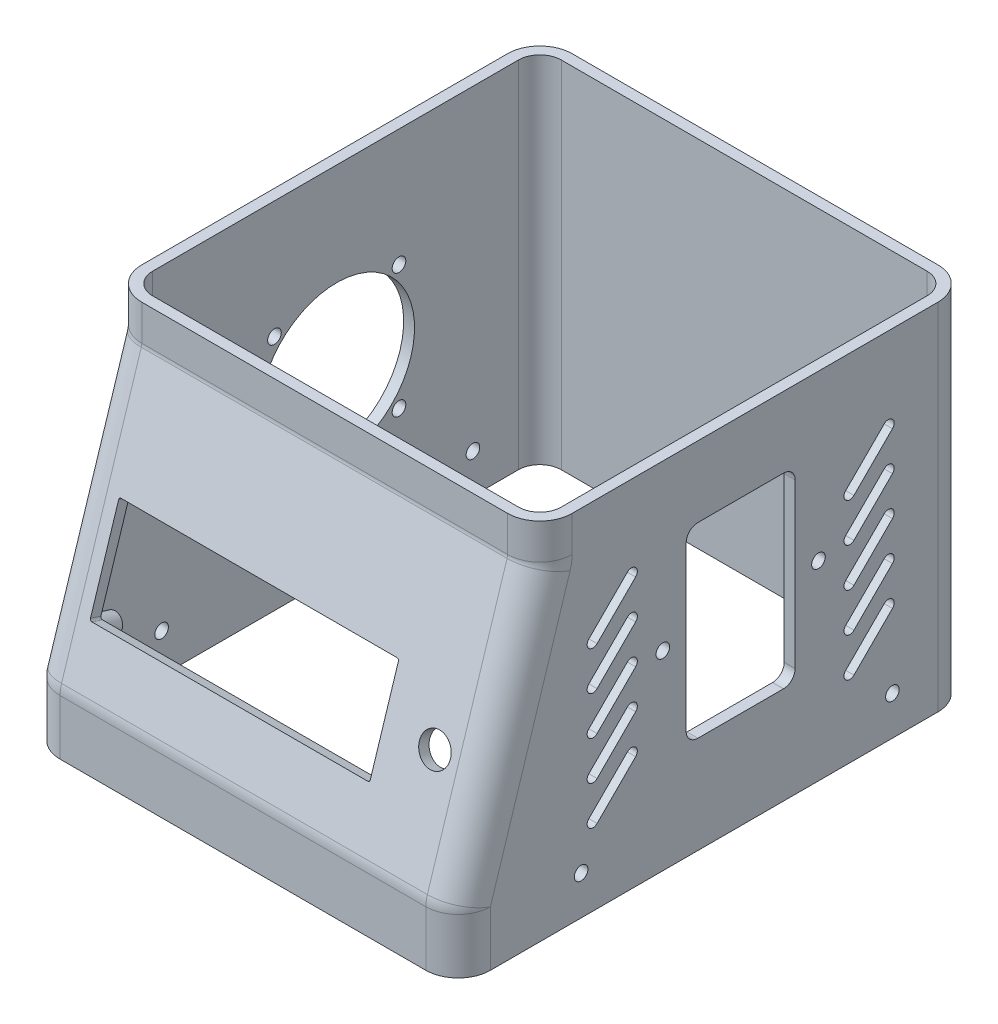
from build123d import *

# Parameters (mm, degrees)
BOSS_EXTRUDE3_DEPTH = 52.5
FILLET3_R           = 5.5
SHELL1_T            = 2.8
CUT_EXTRUDE1_REACH  = 171.85
SKETCH7_R           = 2.5
SKETCH7_R_2         = 1.25
BOSS_EXTRUDE4_DEPTH = 5.7
CUT_EXTRUDE2_REACH  = 173.509
SKETCH8_R           = 4
SKETCH11_R          = 1.75
CUT_EXTRUDE3_DEPTH  = 193.715437887
SKETCH12_R          = 1.75
SKETCH12_W          = 28
SKETCH12_H          = 48
CUT_EXTRUDE4_DEPTH  = 2.8
SKETCH17_R          = 2.5
SKETCH17_R_2        = 1.25
BOSS_EXTRUDE7_DEPTH = 8.4
FILLET4_R           = 3
SKETCH18_R          = 20
SKETCH18_R_2        = 1.75
CUT_EXTRUDE6_DEPTH  = 2.8
CUT_EXTRUDE7_DEPTH  = 2.8


with BuildPart() as part:
    # Sketch4 → Boss-Extrude3 (new, symmetric)
    with BuildSketch(Plane(origin=(0, 0, 0), x_dir=(0, 0, -1), z_dir=(1, 0, 0))):
        Polygon((0, 0), (0, 15), (21, 81.2), (21, 91.2), (126, 91.2), (126, 0), align=None)
    extrude(amount=BOSS_EXTRUDE3_DEPTH, both=True)

    # Fillet3
    fillet3_edges = [part.edges().sort_by_distance(p)[0] for p in [
        (0, 15, 0),
        (0, 81.2, -21),
        (52.5, 86.2, -21),
        (52.5, 48.1, -10.5),
        (52.5, 7.5, 0),
        (-52.5, 7.5, 0),
        (-52.5, 48.1, -10.5),
        (-52.5, 86.2, -21),
        (52.5, 45.6, -126),
        (-52.5, 45.6, -126),
    ]]
    fillet(fillet3_edges, radius=FILLET3_R)

    # Shell1
    shell1_openings = [part.faces().sort_by_distance(p)[0] for p in [
        (0, 0, -63),
        (0, 91.2, -73.5),
    ]]
    offset(amount=SHELL1_T, openings=shell1_openings, kind=Kind.INTERSECTION)

    # Sketch6 → Cut-Extrude1 (cut, up to next)
    with BuildSketch(Plane(origin=(0, 1.371427861, 4.323263065), x_dir=(-1, 0, 0), z_dir=(0, -0.30237150004743096, -0.953190157292377)), mode=Mode.PRIVATE) as cut_extrude1_sk1:
        with BuildLine():
            Line((-27.45, 54.049302099), (43.45, 54.049302099))
            ThreePointArc((43.45, 54.049302099), (43.803553391, 53.902855489), (43.95, 53.549302099))
            Line((43.95, 53.549302099), (43.95, 29.649302099))
            ThreePointArc((43.95, 29.649302099), (43.803553391, 29.295748708), (43.45, 29.149302099))
            Line((43.45, 29.149302099), (-27.45, 29.149302099))
            ThreePointArc((-27.45, 29.149302099), (-27.803553391, 29.295748708), (-27.95, 29.649302099))
            Line((-27.95, 29.649302099), (-27.95, 53.549302099))
            ThreePointArc((-27.95, 53.549302099), (-27.803553391, 53.902855489), (-27.45, 54.049302099))
        make_face()
    cut_extrude1_tool1 = extrude(cut_extrude1_sk1.sketch, amount=-CUT_EXTRUDE1_REACH, mode=Mode.PRIVATE) & part.part
    add(cut_extrude1_tool1.solids().sort_by_distance((-8, 41.023473, -8.25518))[0], mode=Mode.SUBTRACT)

    # Sketch7 → Boss-Extrude4 (add)
    # profile 1 of 4: a face of its own
    with BuildSketch(Plane(origin=(0, 1.371427861, 4.323263065), x_dir=(-1, 0, 0), z_dir=(0, -0.30237150004743096, -0.953190157292377))):
        with Locations(Location((-29.5, 57.599302099, 0), (0, 0, 90))):
            Circle(SKETCH7_R)
        with Locations(Location((-29.5, 57.599302099, 0), (0, 0, 90))):
            Circle(SKETCH7_R_2, mode=Mode.SUBTRACT)
    # profile 2 of 4: a face of its own
    with BuildSketch(Plane(origin=(0, 1.371427861, 4.323263065), x_dir=(-1, 0, 0), z_dir=(0, -0.30237150004743096, -0.953190157292377))):
        with Locations(Location((45.5, 57.599302099, 0), (0, 0, 306.869897646))):
            Circle(SKETCH7_R)
        with Locations(Location((45.5, 57.599302099, 0), (0, 0, 90))):
            Circle(SKETCH7_R_2, mode=Mode.SUBTRACT)
    # profile 3 of 4: a face of its own
    with BuildSketch(Plane(origin=(0, 1.371427861, 4.323263065), x_dir=(-1, 0, 0), z_dir=(0, -0.30237150004743096, -0.953190157292377))):
        with Locations(Location((45.5, 26.599302099, 0), (0, 0, 306.869897646))):
            Circle(SKETCH7_R)
        with Locations(Location((45.5, 26.599302099, 0), (0, 0, 90))):
            Circle(SKETCH7_R_2, mode=Mode.SUBTRACT)
    # profile 4 of 4: a face of its own
    with BuildSketch(Plane(origin=(0, 1.371427861, 4.323263065), x_dir=(-1, 0, 0), z_dir=(0, -0.30237150004743096, -0.953190157292377))):
        with Locations(Location((-29.5, 26.599302099, 0), (0, 0, 90))):
            Circle(SKETCH7_R)
        with Locations(Location((-29.5, 26.599302099, 0), (0, 0, 90))):
            Circle(SKETCH7_R_2, mode=Mode.SUBTRACT)
    extrude(amount=BOSS_EXTRUDE4_DEPTH)

    # Sketch8 → Cut-Extrude2 (cut, up to next)
    with BuildSketch(Plane(origin=(0, 2.218068061, 6.992195506), x_dir=(1, 0, 0), z_dir=(0, 0.30237150004743096, 0.953190157292377)), mode=Mode.PRIVATE) as cut_extrude2_sk1:
        with Locations(Location((40.95, 41.599302099, 0), (0, 0, 270))):
            Circle(SKETCH8_R)
    cut_extrude2_tool1 = extrude(cut_extrude2_sk1.sketch, amount=-CUT_EXTRUDE2_REACH, mode=Mode.PRIVATE) & part.part
    add(cut_extrude2_tool1.solids().sort_by_distance((40.95, 41.870113, -5.586248))[0], mode=Mode.SUBTRACT)

    # Sketch11 → Cut-Extrude3 (cut, through all)
    with BuildSketch(Plane.ZY.offset(55.3)):
        with Locations((-108.8, 10)):
            Circle(SKETCH11_R)
        with Locations((-28.8, 10)):
            Circle(SKETCH11_R)
    extrude(amount=-CUT_EXTRUDE3_DEPTH, mode=Mode.SUBTRACT)

    # Sketch12 → Cut-Extrude4 (cut)
    with BuildSketch(Plane(origin=(55.3, 0, 0), x_dir=(0, 0, -1), z_dir=(1, 0, 0))):
        with Locations((49.8, 49)):
            Circle(SKETCH12_R)
        with Locations(Location((89.8, 49, 0), (0, 0, 180))):
            Circle(SKETCH12_R)
        with Locations((69.8, 49)):
            Rectangle(SKETCH12_W, SKETCH12_H)
    extrude(amount=-CUT_EXTRUDE4_DEPTH, mode=Mode.SUBTRACT)

    # Sketch17 → Boss-Extrude7 (add)
    # profile 1 of 2: a face of its own
    with BuildSketch(Plane(origin=(0, 1.371427861, 4.323263065), x_dir=(-1, 0, 0), z_dir=(0, -0.30237150004743096, -0.9531901572923771))):
        with Locations(Location((-40.95, 61.599302099, 0), (0, 0, 90))):
            Circle(SKETCH17_R)
        with Locations(Location((-40.95, 61.599302099, 0), (0, 0, 90))):
            Circle(SKETCH17_R_2, mode=Mode.SUBTRACT)
    # profile 2 of 2: a face of its own
    with BuildSketch(Plane(origin=(0, 1.371427861, 4.323263065), x_dir=(-1, 0, 0), z_dir=(0, -0.30237150004743096, -0.9531901572923771))):
        with Locations(Location((-40.95, 29.599302099, 0), (0, 0, 90))):
            Circle(SKETCH17_R)
        with Locations(Location((-40.95, 29.599302099, 0), (0, 0, 90))):
            Circle(SKETCH17_R_2, mode=Mode.SUBTRACT)
    extrude(amount=BOSS_EXTRUDE7_DEPTH)

    # Fillet4
    fillet4_edges = [part.edges().sort_by_distance(p)[0] for p in [
        (53.9, 25, -83.8),
        (53.9, 73, -83.8),
        (53.9, 73, -55.8),
        (53.9, 25, -55.8),
    ]]
    fillet(fillet4_edges, radius=FILLET4_R)

    # Sketch18 → Cut-Extrude6 (cut)
    with BuildSketch(Plane.ZY.offset(55.3)):
        with Locations((-73.8, 45)):
            Circle(SKETCH18_R)
        with Locations((-89.8, 61)):
            Circle(SKETCH18_R_2)
        with Locations((-57.8, 61)):
            Circle(SKETCH18_R_2)
        with Locations((-57.8, 29)):
            Circle(SKETCH18_R_2)
        with Locations((-89.8, 29)):
            Circle(SKETCH18_R_2)
    extrude(amount=-CUT_EXTRUDE6_DEPTH, mode=Mode.SUBTRACT)

    # Sketch20 → Cut-Extrude7 (cut)
    with BuildSketch(Plane(origin=(55.3, 0, 0), x_dir=(0, 0, -1), z_dir=(1, 0, 0))):
        with BuildLine():
            Line((30.78959236, 61.110912703), (40.689087297, 71.01040764))
            ThreePointArc((40.689087297, 71.01040764), (42.81040764, 71.01040764), (42.81040764, 68.889087297))
            Line((42.81040764, 68.889087297), (32.910912703, 58.98959236))
            ThreePointArc((32.910912703, 58.98959236), (30.78959236, 58.98959236), (30.78959236, 61.110912703))
        make_face()
        with BuildLine():
            Line((30.78959236, 51.110912703), (40.689087297, 61.01040764))
            ThreePointArc((40.689087297, 61.01040764), (42.81040764, 61.01040764), (42.81040764, 58.889087297))
            Line((42.81040764, 58.889087297), (32.910912703, 48.98959236))
            ThreePointArc((32.910912703, 48.98959236), (30.78959236, 48.98959236), (30.78959236, 51.110912703))
        make_face()
        with BuildLine():
            Line((30.78959236, 41.110912703), (40.689087297, 51.01040764))
            ThreePointArc((40.689087297, 51.01040764), (42.81040764, 51.01040764), (42.81040764, 48.889087297))
            Line((42.81040764, 48.889087297), (32.910912703, 38.98959236))
            ThreePointArc((32.910912703, 38.98959236), (30.78959236, 38.98959236), (30.78959236, 41.110912703))
        make_face()
        with BuildLine():
            Line((30.78959236, 31.110912703), (40.689087297, 41.01040764))
            ThreePointArc((40.689087297, 41.01040764), (42.81040764, 41.01040764), (42.81040764, 38.889087297))
            Line((42.81040764, 38.889087297), (32.910912703, 28.98959236))
            ThreePointArc((32.910912703, 28.98959236), (30.78959236, 28.98959236), (30.78959236, 31.110912703))
        make_face()
        with BuildLine():
            Line((30.78959236, 21.110912703), (40.689087297, 31.01040764))
            ThreePointArc((40.689087297, 31.01040764), (42.81040764, 31.01040764), (42.81040764, 28.889087297))
            Line((42.81040764, 28.889087297), (32.910912703, 18.98959236))
            ThreePointArc((32.910912703, 18.98959236), (30.78959236, 18.98959236), (30.78959236, 21.110912703))
        make_face()
        with BuildLine():
            Line((96.78959236, 61.110912703), (106.689087297, 71.01040764))
            ThreePointArc((106.689087297, 71.01040764), (108.81040764, 71.01040764), (108.81040764, 68.889087297))
            Line((108.81040764, 68.889087297), (98.910912703, 58.98959236))
            ThreePointArc((98.910912703, 58.98959236), (96.78959236, 58.98959236), (96.78959236, 61.110912703))
        make_face()
        with BuildLine():
            Line((96.78959236, 51.110912703), (106.689087297, 61.01040764))
            ThreePointArc((106.689087297, 61.01040764), (108.81040764, 61.01040764), (108.81040764, 58.889087297))
            Line((108.81040764, 58.889087297), (98.910912703, 48.98959236))
            ThreePointArc((98.910912703, 48.98959236), (96.78959236, 48.98959236), (96.78959236, 51.110912703))
        make_face()
        with BuildLine():
            Line((96.78959236, 41.110912703), (106.689087297, 51.01040764))
            ThreePointArc((106.689087297, 51.01040764), (108.81040764, 51.01040764), (108.81040764, 48.889087297))
            Line((108.81040764, 48.889087297), (98.910912703, 38.98959236))
            ThreePointArc((98.910912703, 38.98959236), (96.78959236, 38.98959236), (96.78959236, 41.110912703))
        make_face()
        with BuildLine():
            Line((96.78959236, 31.110912703), (106.689087297, 41.01040764))
            ThreePointArc((106.689087297, 41.01040764), (108.81040764, 41.01040764), (108.81040764, 38.889087297))
            Line((108.81040764, 38.889087297), (98.910912703, 28.98959236))
            ThreePointArc((98.910912703, 28.98959236), (96.78959236, 28.98959236), (96.78959236, 31.110912703))
        make_face()
        with BuildLine():
            Line((96.78959236, 21.110912703), (106.689087297, 31.01040764))
            ThreePointArc((106.689087297, 31.01040764), (108.81040764, 31.01040764), (108.81040764, 28.889087297))
            Line((108.81040764, 28.889087297), (98.910912703, 18.98959236))
            ThreePointArc((98.910912703, 18.98959236), (96.78959236, 18.98959236), (96.78959236, 21.110912703))
        make_face()
    extrude(amount=-CUT_EXTRUDE7_DEPTH, mode=Mode.SUBTRACT)


solid = part.part
